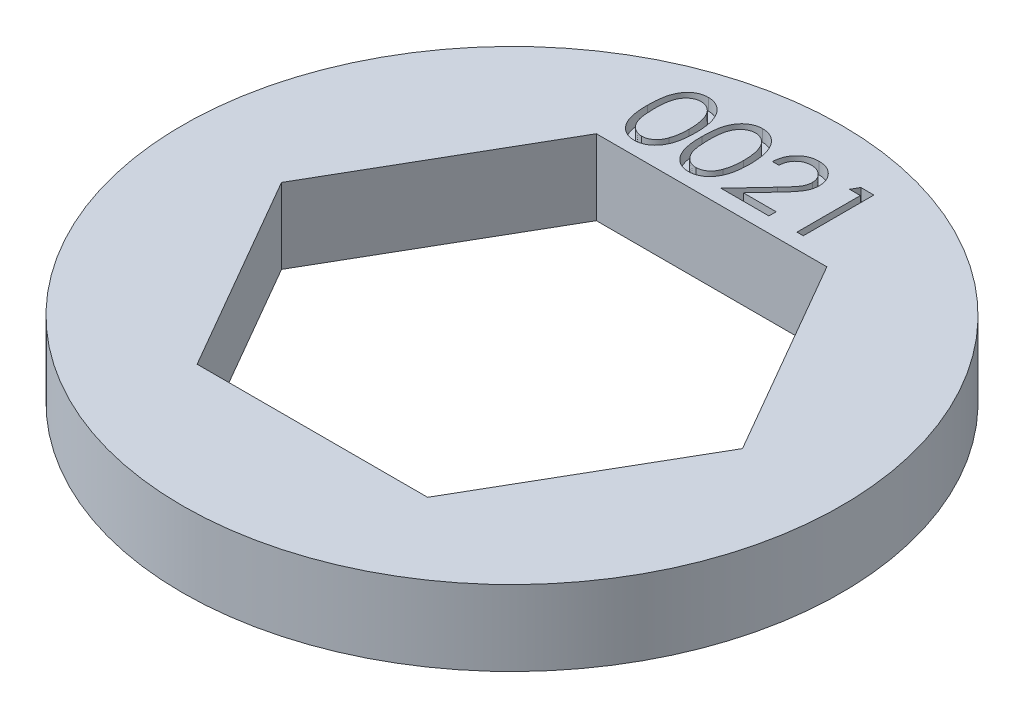
from build123d import *

# Parameters (mm, degrees)
SKETCH1_R           = 11.1125
BOSS_EXTRUDE1_DEPTH = 2.54
CUT_EXTRUDE1_DEPTH  = 0.4


with BuildPart() as part:
    # Sketch1 → Boss-Extrude1 (new body)
    with BuildSketch(Plane(origin=(0, 0, 0), x_dir=(1, 0, 0), z_dir=(0, 1, 0))):
        with Locations(Location((0, 0, 0), (0, 0, 270))):
            Circle(SKETCH1_R)
        Polygon((7.772289324, 0), (3.886144662, 6.731), (-3.886144662, 6.731), (-7.772289324, 0), (-3.886144662, -6.731), (3.886144662, -6.731), align=None, mode=Mode.SUBTRACT)
    extrude(amount=BOSS_EXTRUDE1_DEPTH)

    # Sketch2 → Cut-Extrude1 (cut)
    # profile 1 of 4: a face of its own
    with BuildSketch(Plane(origin=(0, 2.54, 0), x_dir=(1, 0, 0), z_dir=(0, 1, 0))):
        with BuildLine():
            add(Edge.make_bspline(
                [(-3.858167899, 8.428670974), (-3.857944729, 8.466837232), (-3.857511219, 8.540975739), (-3.852688561, 8.649006005), (-3.844677123, 8.750352201), (-3.833697946, 8.84501918), (-3.820337106, 8.933031381), (-3.802501213, 9.014153599), (-3.782217859, 9.088761296), (-3.758709856, 9.157097761), (-3.732184235, 9.220083663), (-3.703313783, 9.278883666), (-3.670952735, 9.333408802), (-3.636950586, 9.384529334), (-3.599930944, 9.431408455), (-3.560947303, 9.474708195), (-3.518478133, 9.513427831), (-3.473967122, 9.548701833), (-3.427011278, 9.579623705), (-3.378949035, 9.606860265), (-3.329449579, 9.630128389), (-3.278377766, 9.648423489), (-3.226192632, 9.663534797), (-3.172711753, 9.673868706), (-3.117846825, 9.680370817), (-3.08081401, 9.680992438), (-3.062032833, 9.681307692)],
                knots=[0, 0, 0, 0, 1.646270934, 3.197905019, 4.663502075, 6.030701355, 7.308322542, 8.50163776, 9.611534131, 10.641858119, 11.616356847, 12.558055219, 13.465016945, 14.349605745, 15.204443733, 16.039544428, 16.859896111, 17.680448484, 18.487036065, 19.28249412, 20.06191084, 20.843045899, 21.620316918, 22.403196591, 23.190181807, 24, 24, 24, 24], degree=3))
            add(Edge.make_bspline(
                [(-3.062032833, 9.681307692), (-3.043094766, 9.680975804), (-3.00543291, 9.680315782), (-2.949752226, 9.673972171), (-2.895357889, 9.663446282), (-2.842481798, 9.64853219), (-2.79068962, 9.630029417), (-2.740386457, 9.606838004), (-2.691259853, 9.579842203), (-2.644090497, 9.548121315), (-2.598360553, 9.512754802), (-2.555193278, 9.472775201), (-2.514584743, 9.428586195), (-2.476025294, 9.38066057), (-2.440608897, 9.32807911), (-2.406881258, 9.27175635), (-2.376692427, 9.210707315), (-2.347617585, 9.145950604), (-2.32252126, 9.075694436), (-2.299888333, 9.00033484), (-2.281601034, 8.918981688), (-2.266368333, 8.832061814), (-2.254567609, 8.739256008), (-2.245972901, 8.640763212), (-2.24143282, 8.536518624), (-2.240577814, 8.465245874), (-2.240139053, 8.428670974)],
                knots=[0, 0, 0, 0, 0.810914788, 1.612654377, 2.396697861, 3.181598691, 3.963628158, 4.749916497, 5.551656086, 6.361998678, 7.18212741, 8.025565596, 8.878627764, 9.750805457, 10.657531673, 11.591944965, 12.560506719, 13.57287815, 14.630710178, 15.753379473, 16.941251878, 18.199788006, 19.531962791, 20.947069417, 22.433333509, 24, 24, 24, 24], degree=3))
            add(Edge.make_bspline(
                [(-2.240139053, 8.428670974), (-2.240582363, 8.3922556), (-2.241446135, 8.321301731), (-2.245922005, 8.217526193), (-2.254738502, 8.119556095), (-2.265767083, 8.027156477), (-2.281041756, 7.940711918), (-2.299823128, 7.859923285), (-2.320676294, 7.784441693), (-2.346417467, 7.714885509), (-2.374591539, 7.650284426), (-2.405245164, 7.589959098), (-2.438085885, 7.533376317), (-2.473865013, 7.480988989), (-2.512001353, 7.43242601), (-2.553311135, 7.388544592), (-2.596629872, 7.348287402), (-2.642494391, 7.312465492), (-2.690399392, 7.281111366), (-2.739357264, 7.253071228), (-2.790236673, 7.230461127), (-2.841884593, 7.211047108), (-2.895039785, 7.196215014), (-2.94963599, 7.185959409), (-3.005395501, 7.178766777), (-3.043088351, 7.178218082), (-3.062032833, 7.177942308)],
                knots=[0, 0, 0, 0, 1.561518951, 3.042555995, 4.452378317, 5.7783523, 7.031515105, 8.214008947, 9.334062868, 10.386615937, 11.391082383, 12.354592575, 13.286541444, 14.194233754, 15.072674879, 15.931287219, 16.775624067, 17.606195743, 18.42308326, 19.229000347, 20.022332153, 20.807536673, 21.593273796, 22.3848459, 23.188221202, 24, 24, 24, 24], degree=3))
            add(Edge.make_bspline(
                [(-3.062032833, 7.177942308), (-3.080813489, 7.178259596), (-3.117845277, 7.178885226), (-3.172717731, 7.185357962), (-3.22597775, 7.195764367), (-3.277888152, 7.210335306), (-3.328715264, 7.228170757), (-3.377766487, 7.25140746), (-3.425587215, 7.278168675), (-3.472049863, 7.30864556), (-3.516281351, 7.343562633), (-3.558530581, 7.382182623), (-3.597736174, 7.425469265), (-3.634226514, 7.472739066), (-3.668907099, 7.523557147), (-3.700808619, 7.578617344), (-3.730316289, 7.637701334), (-3.757288021, 7.701190841), (-3.781201666, 7.770012319), (-3.802325196, 7.844953099), (-3.819003578, 7.92667463), (-3.833279481, 8.014520553), (-3.844794106, 8.108868352), (-3.852655174, 8.209769248), (-3.857513819, 8.317160363), (-3.857945893, 8.390822477), (-3.858167899, 8.428670974)],
                knots=[0, 0, 0, 0, 0.810891512, 1.598919785, 2.382837074, 3.152667961, 3.926044502, 4.706494248, 5.493654104, 6.291793342, 7.103789334, 7.925228297, 8.761435821, 9.622817696, 10.50288917, 11.416980706, 12.369136599, 13.353924996, 14.394355917, 15.514179734, 16.714354668, 17.994756427, 19.357759367, 20.818452758, 22.365282078, 24, 24, 24, 24], degree=3))
        make_face()
        with BuildLine():
            add(Edge.make_bspline(
                [(-3.644465976, 8.429625), (-3.644384709, 8.397819189), (-3.644226986, 8.336090355), (-3.640106607, 8.24638985), (-3.634493503, 8.162726109), (-3.62725362, 8.084992899), (-3.616501971, 8.013453337), (-3.604455032, 7.947615392), (-3.589794635, 7.887827486), (-3.572448918, 7.833679351), (-3.552691961, 7.784252038), (-3.53112065, 7.738259068), (-3.507947194, 7.695157126), (-3.482012557, 7.655333367), (-3.453767487, 7.618657924), (-3.423849966, 7.584481657), (-3.39114344, 7.554003711), (-3.345897144, 7.517450261), (-3.286164186, 7.479677422), (-3.210902769, 7.446784815), (-3.133567626, 7.426113893), (-3.081077222, 7.42348516), (-3.054877634, 7.422173077)],
                knots=[0, 0, 0, 0, 1.459021318, 2.831673884, 4.118529203, 5.306027144, 6.411944654, 7.436330062, 8.375795394, 9.233974572, 10.042671642, 10.816086306, 11.563610507, 12.285937304, 12.993564865, 13.685989202, 14.367179055, 15.041617293, 16.353048772, 17.594441528, 18.799311195, 20, 20, 20, 20], degree=3))
            add(Edge.make_bspline(
                [(-3.054877634, 7.422173077), (-3.028508576, 7.423260139), (-2.9758249, 7.425432017), (-2.898853515, 7.446386158), (-2.824129706, 7.478002041), (-2.765570047, 7.515385969), (-2.72101853, 7.550987922), (-2.689098221, 7.581341817), (-2.659800649, 7.615329648), (-2.632013451, 7.652000419), (-2.606527902, 7.692054734), (-2.583352803, 7.735299986), (-2.562205025, 7.781856266), (-2.550156549, 7.814356749), (-2.543996474, 7.830973407)],
                knots=[0, 0, 0, 0, 1.353760809, 2.704726607, 4.075137775, 5.516104923, 6.260822281, 7.007110065, 7.778089737, 8.566572457, 9.372053459, 10.217411131, 11.088608312, 12, 12, 12, 12], degree=3))
            add(Edge.make_bspline(
                [(-2.543996474, 7.830973407), (-2.536817504, 7.852220784), (-2.522241115, 7.89536207), (-2.503455247, 7.962284483), (-2.488660609, 8.032499221), (-2.475350534, 8.105586666), (-2.466265687, 8.18208582), (-2.458953335, 8.261759985), (-2.454646207, 8.344669233), (-2.454112296, 8.400999397), (-2.453840976, 8.429625)],
                knots=[0, 0, 0, 0, 0.884706709, 1.796334032, 2.740027952, 3.714592787, 4.726048262, 5.777819803, 6.87074269, 8, 8, 8, 8], degree=3))
            add(Edge.make_bspline(
                [(-2.453840976, 8.429625), (-2.454215301, 8.458245973), (-2.454947561, 8.514234716), (-2.457746542, 8.596230121), (-2.464974367, 8.67410908), (-2.473001981, 8.748207098), (-2.484838305, 8.818114), (-2.497600313, 8.884415011), (-2.514746138, 8.946288748), (-2.533061199, 9.004703928), (-2.554023272, 9.058996873), (-2.577098084, 9.109420717), (-2.601741816, 9.156218896), (-2.62850859, 9.199263011), (-2.657080653, 9.238745866), (-2.688212129, 9.273875832), (-2.720668139, 9.305741697), (-2.766127689, 9.342115338), (-2.825641447, 9.37920276), (-2.899695361, 9.413333393), (-2.976759852, 9.43293332), (-3.028857149, 9.435696718), (-3.054877634, 9.437076923)],
                knots=[0, 0, 0, 0, 1.31362396, 2.569729283, 3.763502607, 4.902122613, 5.988968491, 7.01645872, 7.998833611, 8.933434873, 9.825090667, 10.667526885, 11.477055099, 12.250526234, 12.991942729, 13.710640831, 14.402115721, 15.076753259, 16.378508321, 17.609869233, 18.806226677, 20, 20, 20, 20], degree=3))
            add(Edge.make_bspline(
                [(-3.054877634, 9.437076923), (-3.081214662, 9.435694814), (-3.133936698, 9.432928077), (-3.211802181, 9.413406417), (-3.28644032, 9.379379739), (-3.345796701, 9.3419925), (-3.391287956, 9.306383756), (-3.423321003, 9.275504757), (-3.453356166, 9.241727574), (-3.481024727, 9.204714842), (-3.506939043, 9.164937512), (-3.530738624, 9.122082656), (-3.552181665, 9.075933103), (-3.571969537, 9.026527992), (-3.589368166, 8.972384528), (-3.603719594, 8.912670267), (-3.61697775, 8.84704173), (-3.62636346, 8.775114707), (-3.634707193, 8.697362028), (-3.640069325, 8.613489424), (-3.64424077, 8.523638479), (-3.644389403, 8.46159048), (-3.644465976, 8.429625)],
                knots=[0, 0, 0, 0, 1.207732386, 2.417664972, 3.655092373, 4.956220595, 5.625982001, 6.301752483, 6.994047911, 7.697131622, 8.419323945, 9.170223765, 9.943494443, 10.752040957, 11.610060368, 12.549350801, 13.567764191, 14.679664412, 15.874934091, 17.154273443, 18.533957287, 20, 20, 20, 20], degree=3))
        make_face(mode=Mode.SUBTRACT)
    # profile 2 of 4: a face of its own
    with BuildSketch(Plane(origin=(0, 2.54, 0), x_dir=(1, 0, 0), z_dir=(0, 1, 0))):
        with BuildLine():
            add(Edge.make_bspline(
                [(-2.026437129, 8.428670974), (-2.02621396, 8.466837232), (-2.02578045, 8.540975739), (-2.020957792, 8.649006005), (-2.012946354, 8.750352201), (-2.001967177, 8.84501918), (-1.988606337, 8.933031381), (-1.970770443, 9.014153599), (-1.95048709, 9.088761296), (-1.926979087, 9.157097761), (-1.900453466, 9.220083663), (-1.871583014, 9.278883666), (-1.839221966, 9.333408802), (-1.805219816, 9.384529334), (-1.768200175, 9.431408455), (-1.729216533, 9.474708195), (-1.686747364, 9.513427831), (-1.642236353, 9.548701833), (-1.595280509, 9.579623705), (-1.547218266, 9.606860265), (-1.49771881, 9.630128389), (-1.446646996, 9.648423489), (-1.394461863, 9.663534797), (-1.340980984, 9.673868706), (-1.286116056, 9.680370817), (-1.249083241, 9.680992438), (-1.230302063, 9.681307692)],
                knots=[0, 0, 0, 0, 1.646270934, 3.197905019, 4.663502075, 6.030701355, 7.308322542, 8.50163776, 9.611534131, 10.641858119, 11.616356847, 12.558055219, 13.465016945, 14.349605745, 15.204443733, 16.039544428, 16.859896111, 17.680448484, 18.487036065, 19.28249412, 20.06191084, 20.843045899, 21.620316918, 22.403196591, 23.190181807, 24, 24, 24, 24], degree=3))
            add(Edge.make_bspline(
                [(-1.230302063, 9.681307692), (-1.211363997, 9.680975804), (-1.173702141, 9.680315782), (-1.118021457, 9.673972171), (-1.06362712, 9.663446282), (-1.010751029, 9.64853219), (-0.958958851, 9.630029417), (-0.908655688, 9.606838004), (-0.859529084, 9.579842203), (-0.812359728, 9.548121315), (-0.766629784, 9.512754802), (-0.723462509, 9.472775201), (-0.682853974, 9.428586195), (-0.644294525, 9.38066057), (-0.608878128, 9.32807911), (-0.575150489, 9.27175635), (-0.544961657, 9.210707315), (-0.515886816, 9.145950604), (-0.490790491, 9.075694436), (-0.468157563, 9.00033484), (-0.449870265, 8.918981688), (-0.434637564, 8.832061814), (-0.42283684, 8.739256008), (-0.414242132, 8.640763212), (-0.409702051, 8.536518624), (-0.408847045, 8.465245874), (-0.408408283, 8.428670974)],
                knots=[0, 0, 0, 0, 0.810914788, 1.612654377, 2.396697861, 3.181598691, 3.963628158, 4.749916497, 5.551656086, 6.361998678, 7.18212741, 8.025565596, 8.878627764, 9.750805457, 10.657531673, 11.591944965, 12.560506719, 13.57287815, 14.630710178, 15.753379473, 16.941251878, 18.199788006, 19.531962791, 20.947069417, 22.433333509, 24, 24, 24, 24], degree=3))
            add(Edge.make_bspline(
                [(-0.408408283, 8.428670974), (-0.408851594, 8.3922556), (-0.409715365, 8.321301731), (-0.414191236, 8.217526193), (-0.423007733, 8.119556095), (-0.434036314, 8.027156477), (-0.449310987, 7.940711918), (-0.468092359, 7.859923285), (-0.488945525, 7.784441693), (-0.514686698, 7.714885509), (-0.54286077, 7.650284426), (-0.573514395, 7.589959098), (-0.606355116, 7.533376317), (-0.642134244, 7.480988989), (-0.680270584, 7.43242601), (-0.721580365, 7.388544592), (-0.764899103, 7.348287402), (-0.810763621, 7.312465492), (-0.858668623, 7.281111366), (-0.907626495, 7.253071228), (-0.958505904, 7.230461127), (-1.010153824, 7.211047108), (-1.063309016, 7.196215014), (-1.117905221, 7.185959409), (-1.173664731, 7.178766777), (-1.211357582, 7.178218082), (-1.230302063, 7.177942308)],
                knots=[0, 0, 0, 0, 1.561518951, 3.042555995, 4.452378317, 5.7783523, 7.031515105, 8.214008947, 9.334062868, 10.386615937, 11.391082383, 12.354592575, 13.286541444, 14.194233754, 15.072674879, 15.931287219, 16.775624067, 17.606195743, 18.42308326, 19.229000347, 20.022332153, 20.807536673, 21.593273796, 22.3848459, 23.188221202, 24, 24, 24, 24], degree=3))
            add(Edge.make_bspline(
                [(-1.230302063, 7.177942308), (-1.24908272, 7.178259596), (-1.286114508, 7.178885226), (-1.340986961, 7.185357962), (-1.394246981, 7.195764367), (-1.446157383, 7.210335306), (-1.496984494, 7.228170757), (-1.546035718, 7.25140746), (-1.593856446, 7.278168675), (-1.640319094, 7.30864556), (-1.684550582, 7.343562633), (-1.726799811, 7.382182623), (-1.766005405, 7.425469265), (-1.802495745, 7.472739066), (-1.83717633, 7.523557147), (-1.86907785, 7.578617344), (-1.89858552, 7.637701334), (-1.925557252, 7.701190841), (-1.949470897, 7.770012319), (-1.970594427, 7.844953099), (-1.987272809, 7.92667463), (-2.001548712, 8.014520553), (-2.013063337, 8.108868352), (-2.020924405, 8.209769248), (-2.02578305, 8.317160363), (-2.026215124, 8.390822477), (-2.026437129, 8.428670974)],
                knots=[0, 0, 0, 0, 0.810891512, 1.598919785, 2.382837074, 3.152667961, 3.926044502, 4.706494248, 5.493654104, 6.291793342, 7.103789334, 7.925228297, 8.761435821, 9.622817696, 10.50288917, 11.416980706, 12.369136599, 13.353924996, 14.394355917, 15.514179734, 16.714354668, 17.994756427, 19.357759367, 20.818452758, 22.365282078, 24, 24, 24, 24], degree=3))
        make_face()
        with BuildLine():
            add(Edge.make_bspline(
                [(-1.812735206, 8.429625), (-1.81265394, 8.397819189), (-1.812496217, 8.336090355), (-1.808375838, 8.24638985), (-1.802762734, 8.162726109), (-1.795522851, 8.084992899), (-1.784771202, 8.013453337), (-1.772724262, 7.947615392), (-1.758063866, 7.887827486), (-1.740718148, 7.833679351), (-1.720961191, 7.784252038), (-1.69938988, 7.738259068), (-1.676216424, 7.695157126), (-1.650281788, 7.655333367), (-1.622036718, 7.618657924), (-1.592119197, 7.584481657), (-1.559412671, 7.554003711), (-1.514166375, 7.517450261), (-1.454433416, 7.479677422), (-1.379172, 7.446784815), (-1.301836857, 7.426113893), (-1.249346453, 7.42348516), (-1.223146865, 7.422173077)],
                knots=[0, 0, 0, 0, 1.459021318, 2.831673884, 4.118529203, 5.306027144, 6.411944654, 7.436330062, 8.375795394, 9.233974572, 10.042671642, 10.816086306, 11.563610507, 12.285937304, 12.993564865, 13.685989202, 14.367179055, 15.041617293, 16.353048772, 17.594441528, 18.799311195, 20, 20, 20, 20], degree=3))
            add(Edge.make_bspline(
                [(-1.223146865, 7.422173077), (-1.196777806, 7.423260139), (-1.144094131, 7.425432017), (-1.067122745, 7.446386158), (-0.992398937, 7.478002041), (-0.933839277, 7.515385969), (-0.889287761, 7.550987922), (-0.857367452, 7.581341817), (-0.82806988, 7.615329648), (-0.800282682, 7.652000419), (-0.774797132, 7.692054734), (-0.751622033, 7.735299986), (-0.730474256, 7.781856266), (-0.71842578, 7.814356749), (-0.712265705, 7.830973407)],
                knots=[0, 0, 0, 0, 1.353760809, 2.704726607, 4.075137775, 5.516104923, 6.260822281, 7.007110065, 7.778089737, 8.566572457, 9.372053459, 10.217411131, 11.088608312, 12, 12, 12, 12], degree=3))
            add(Edge.make_bspline(
                [(-0.712265705, 7.830973407), (-0.705086735, 7.852220784), (-0.690510346, 7.89536207), (-0.671724478, 7.962284483), (-0.65692984, 8.032499221), (-0.643619764, 8.105586666), (-0.634534917, 8.18208582), (-0.627222566, 8.261759985), (-0.622915438, 8.344669233), (-0.622381527, 8.400999397), (-0.622110206, 8.429625)],
                knots=[0, 0, 0, 0, 0.884706709, 1.796334032, 2.740027952, 3.714592787, 4.726048262, 5.777819803, 6.87074269, 8, 8, 8, 8], degree=3))
            add(Edge.make_bspline(
                [(-0.622110206, 8.429625), (-0.622484532, 8.458245973), (-0.623216792, 8.514234716), (-0.626015773, 8.596230121), (-0.633243597, 8.67410908), (-0.641271212, 8.748207098), (-0.653107536, 8.818114), (-0.665869544, 8.884415011), (-0.683015368, 8.946288748), (-0.70133043, 9.004703928), (-0.722292502, 9.058996873), (-0.745367314, 9.109420717), (-0.770011047, 9.156218896), (-0.796777821, 9.199263011), (-0.825349884, 9.238745866), (-0.856481359, 9.273875832), (-0.88893737, 9.305741697), (-0.93439692, 9.342115338), (-0.993910678, 9.37920276), (-1.067964591, 9.413333393), (-1.145029083, 9.43293332), (-1.19712638, 9.435696718), (-1.223146865, 9.437076923)],
                knots=[0, 0, 0, 0, 1.31362396, 2.569729283, 3.763502607, 4.902122613, 5.988968491, 7.01645872, 7.998833611, 8.933434873, 9.825090667, 10.667526885, 11.477055099, 12.250526234, 12.991942729, 13.710640831, 14.402115721, 15.076753259, 16.378508321, 17.609869233, 18.806226677, 20, 20, 20, 20], degree=3))
            add(Edge.make_bspline(
                [(-1.223146865, 9.437076923), (-1.249483893, 9.435694814), (-1.302205928, 9.432928077), (-1.380071412, 9.413406417), (-1.454709551, 9.379379739), (-1.514065932, 9.3419925), (-1.559557187, 9.306383756), (-1.591590234, 9.275504757), (-1.621625397, 9.241727574), (-1.649293957, 9.204714842), (-1.675208273, 9.164937512), (-1.699007855, 9.122082656), (-1.720450895, 9.075933103), (-1.740238767, 9.026527992), (-1.757637396, 8.972384528), (-1.771988825, 8.912670267), (-1.785246981, 8.84704173), (-1.79463269, 8.775114707), (-1.802976424, 8.697362028), (-1.808338556, 8.613489424), (-1.81251, 8.523638479), (-1.812658634, 8.46159048), (-1.812735206, 8.429625)],
                knots=[0, 0, 0, 0, 1.207732386, 2.417664972, 3.655092373, 4.956220595, 5.625982001, 6.301752483, 6.994047911, 7.697131622, 8.419323945, 9.170223765, 9.943494443, 10.752040957, 11.610060368, 12.549350801, 13.567764191, 14.679664412, 15.874934091, 17.154273443, 18.533957287, 20, 20, 20, 20], degree=3))
        make_face(mode=Mode.SUBTRACT)
    # profile 3 of 4: a face of its own
    with BuildSketch(Plane(origin=(0, 2.54, 0), x_dir=(1, 0, 0), z_dir=(0, 1, 0))):
        with BuildLine():
            Line((0.110582101, 8.887557692), (-0.103119822, 8.887557692))
            add(Edge.make_bspline(
                [(-0.103119822, 8.887557692), (-0.101727027, 8.915908778), (-0.098991614, 8.971589557), (-0.086181653, 9.052772429), (-0.067852235, 9.130370426), (-0.041936442, 9.203760493), (-0.009751278, 9.273591538), (0.028845401, 9.339586192), (0.074561218, 9.401492697), (0.126409013, 9.45873716), (0.182721248, 9.511252275), (0.243481182, 9.556601646), (0.307329317, 9.594917776), (0.374071944, 9.626949835), (0.444462077, 9.650993551), (0.51786095, 9.668833631), (0.594591041, 9.679567181), (0.646869699, 9.680720921), (0.673457702, 9.681307692)],
                knots=[0, 0, 0, 0, 1.10065271, 2.161652631, 3.183658789, 4.190468796, 5.17591951, 6.163126047, 7.15150782, 8.156236427, 9.156009102, 10.134482811, 11.092018607, 12.041330605, 13.001268258, 13.972401359, 14.968799086, 16, 16, 16, 16], degree=3))
            add(Edge.make_bspline(
                [(0.673457702, 9.681307692), (0.699568499, 9.680696421), (0.750875282, 9.679495295), (0.82575676, 9.66918038), (0.897042741, 9.653024897), (0.964593882, 9.630358516), (1.027871222, 9.599889111), (1.087350115, 9.563287571), (1.143738666, 9.520955865), (1.194497925, 9.471117109), (1.241107886, 9.417911558), (1.281318527, 9.361109967), (1.315753554, 9.302443256), (1.344456244, 9.241464069), (1.36558551, 9.177598245), (1.381627112, 9.111775594), (1.390694513, 9.043314785), (1.392086132, 8.996978004), (1.39279364, 8.973420072)],
                knots=[0, 0, 0, 0, 1.111607364, 2.184268762, 3.212621178, 4.221274766, 5.211760367, 6.196651075, 7.1921475, 8.207485113, 9.220403448, 10.201281604, 11.166441695, 12.114753415, 13.065576456, 14.026450734, 14.996634279, 16, 16, 16, 16], degree=3))
            add(Edge.make_bspline(
                [(1.39279364, 8.973420072), (1.391641616, 8.940254135), (1.389357786, 8.874504275), (1.369821754, 8.777883449), (1.33931011, 8.684270783), (1.302572623, 8.608929869), (1.265511906, 8.548219224), (1.23211487, 8.498234266), (1.193018275, 8.444414295), (1.147653083, 8.386939535), (1.096957718, 8.325359795), (1.040472996, 8.259712273), (0.977796127, 8.19067523), (0.933805255, 8.143522669), (0.911010286, 8.119089393)],
                knots=[0, 0, 0, 0, 1.184426356, 2.348067706, 3.509069118, 4.696110526, 5.333549288, 6.050745305, 6.844228056, 7.710549037, 8.667450064, 9.695053472, 10.805634456, 12, 12, 12, 12], degree=3))
            Line((0.911010286, 8.119089393), (0.315220773, 7.483230769))
            Line((0.315220773, 7.483230769), (1.423322486, 7.483230769))
            Line((1.423322486, 7.483230769), (1.423322486, 7.239))
            Line((1.423322486, 7.239), (-0.19470636, 7.239))
            Line((-0.19470636, 7.239), (0.728791236, 8.224509315))
            add(Edge.make_bspline(
                [(0.728791236, 8.224509315), (0.751275602, 8.247980484), (0.794463467, 8.293063797), (0.855547684, 8.358883561), (0.910410996, 8.419945302), (0.959408544, 8.47613365), (1.001477411, 8.528270485), (1.038810126, 8.574667238), (1.06872243, 8.617362677), (1.10118594, 8.666852273), (1.132627952, 8.727276367), (1.159646537, 8.801118038), (1.176121282, 8.877132473), (1.178097608, 8.928500823), (1.179091717, 8.954339543)],
                knots=[0, 0, 0, 0, 1.329631726, 2.553950428, 3.673215718, 4.687767853, 5.603093632, 6.413772471, 7.123043292, 7.734684054, 8.834405432, 9.900288307, 10.943827018, 12, 12, 12, 12], degree=3))
            add(Edge.make_bspline(
                [(1.179091717, 8.954339543), (1.178659185, 8.970587423), (1.177806748, 9.002608875), (1.170283564, 9.049557436), (1.158914452, 9.094845282), (1.142623125, 9.138611718), (1.121119253, 9.180416706), (1.094943614, 9.220311135), (1.064742518, 9.258879877), (1.029805315, 9.295043103), (0.991425334, 9.328163709), (0.950879961, 9.357503488), (0.907983372, 9.382022955), (0.862916432, 9.402123084), (0.815804782, 9.41789062), (0.766557304, 9.428816189), (0.715310071, 9.435675879), (0.680316925, 9.436604004), (0.662486398, 9.437076923)],
                knots=[0, 0, 0, 0, 0.991446411, 1.95395049, 2.89581595, 3.838931463, 4.798493298, 5.75982156, 6.748411868, 7.785213223, 8.824556874, 9.840280684, 10.836137867, 11.835679398, 12.848801643, 13.863922112, 14.911575587, 16, 16, 16, 16], degree=3))
            add(Edge.make_bspline(
                [(0.662486398, 9.437076923), (0.643864457, 9.436590446), (0.607294038, 9.435635085), (0.55360091, 9.428952165), (0.502379694, 9.417422941), (0.453501542, 9.401654526), (0.406883752, 9.381612191), (0.362753037, 9.356648701), (0.321208464, 9.326860289), (0.282171936, 9.293086981), (0.246205551, 9.255485274), (0.214605087, 9.213568496), (0.186993463, 9.168101986), (0.162902538, 9.119208426), (0.143338399, 9.066444158), (0.128388809, 9.009996487), (0.116559544, 8.950110512), (0.112607675, 8.908754945), (0.110582101, 8.887557692)],
                knots=[0, 0, 0, 0, 1.031018746, 2.02475058, 2.990194455, 3.934040569, 4.864654155, 5.795059489, 6.735614925, 7.690564532, 8.649604399, 9.611025574, 10.590972636, 11.591080095, 12.624614302, 13.701020113, 14.821632451, 16, 16, 16, 16], degree=3))
        make_face()
    # profile 4 of 4: a face of its own
    with BuildSketch(Plane(origin=(0, 2.54, 0), x_dir=(1, 0, 0), z_dir=(0, 1, 0))):
        Polygon((2.143135437, 9.62025), (2.58341864, 9.62025), (2.58341864, 7.239), (2.369716717, 7.239), (2.369716717, 9.376019231), (2.003370563, 9.376019231), align=None)
    extrude(amount=-CUT_EXTRUDE1_DEPTH, mode=Mode.SUBTRACT)


solid = part.part
